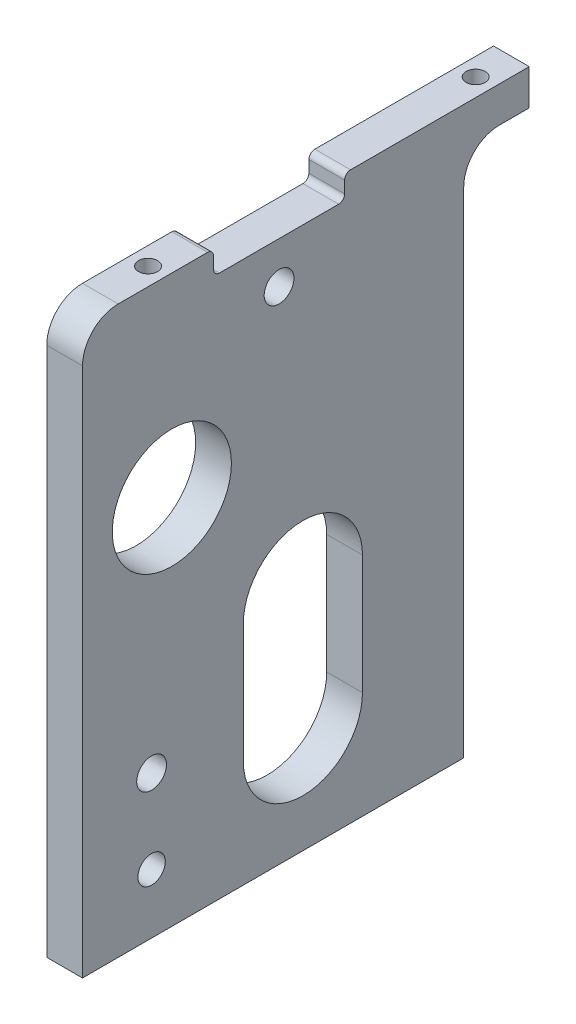
from build123d import *

# Parameters (mm, degrees)
SKETCH1_R                   = 5
SKETCH1_R_2                 = 1.15
BOSS_EXTRUDE1_DEPTH         = 1.5
FILLET1_R                   = 3
TAP_DRILL_FOR_M2_TAP1_D     = 1.6
TAP_DRILL_FOR_M2_TAP1_DEPTH = 6
TAP_DRILL_FOR_M2_TAP1_TIP   = 0.480688495
TAP_DRILL_FOR_M3_TAP1_D     = 2.5
SKETCH10_W                  = 11
SKETCH10_H                  = 2
CUT_EXTRUDE2_DEPTH          = 32.844348091
FILLET3_R                   = 0.5


with BuildPart() as part:
    # Sketch1 → Boss-Extrude1 (new, symmetric)
    with BuildSketch(Plane(origin=(0, 0, 0), x_dir=(0, 0, -1), z_dir=(1, 0, 0))):
        Polygon((-15.5, 23.75), (15.5, 23.75), (21, 23.75), (21, 20.75), (15.5, 20.75), (15.5, 8.25), (15.5, -23.75), (-15.5, -23.75), (-16.5, -23.75), (-16.5, 23.75), align=None)
        with Locations((-9, 7.422)):
            Circle(SKETCH1_R, mode=Mode.SUBTRACT)
        with Locations((-10.7, -18.75)):
            Circle(SKETCH1_R_2, mode=Mode.SUBTRACT)
        with BuildLine():
            Line((7, -4.75), (7, -14.75))
            ThreePointArc((7, -14.75), (2, -19.75), (-3, -14.75))
            Line((-3, -14.75), (-3, -4.75))
            ThreePointArc((-3, -4.75), (2, 0.25), (7, -4.75))
        make_face(mode=Mode.SUBTRACT)
    extrude(amount=BOSS_EXTRUDE1_DEPTH, both=True)

    # Fillet1
    fillet1_edges = [part.edges().sort_by_distance(p)[0] for p in [
        (0, 23.75, 16.5),
        (0, 20.75, -15.5),
    ]]
    fillet(fillet1_edges, radius=FILLET1_R)

    # Tap Drill for M2 Tap1
    with Locations(Plane(origin=(0, 23.75, 0), x_dir=(1, 0, 0), z_dir=(0, 1, 0))):
        with Locations((0, -9.5), (0, 18)):
            Hole(TAP_DRILL_FOR_M2_TAP1_D / 2, depth=TAP_DRILL_FOR_M2_TAP1_DEPTH)
            with Locations((0, 0, -(TAP_DRILL_FOR_M2_TAP1_DEPTH + TAP_DRILL_FOR_M2_TAP1_TIP / 2))):  # 118° drill point
                Cone(0, TAP_DRILL_FOR_M2_TAP1_D / 2, TAP_DRILL_FOR_M2_TAP1_TIP, mode=Mode.SUBTRACT)

    # Tap Drill for M3 Tap1 (through all)
    with Locations(Plane(origin=(1.5, 0, 0), x_dir=(0, 0, -1), z_dir=(1, 0, 0))):
        with Locations((-10.7, -11.75), (0, 18.25)):
            Hole(TAP_DRILL_FOR_M3_TAP1_D / 2)

    # Sketch10 → Cut-Extrude2 (cut, through all)
    with BuildSketch(Plane(origin=(1.5, 0, 0), x_dir=(0, 0, -1), z_dir=(1, 0, 0))):
        with Locations((0, 22.75)):
            Rectangle(SKETCH10_W, SKETCH10_H)
    extrude(amount=-CUT_EXTRUDE2_DEPTH, mode=Mode.SUBTRACT)

    # Fillet3
    fillet3_edges = [part.edges().sort_by_distance(p)[0] for p in [
        (0, 21.75, 5.5),
        (0, 23.75, 5.5),
        (0, 23.75, -5.5),
        (0, 21.75, -5.5),
    ]]
    fillet(fillet3_edges, radius=FILLET3_R)


solid = part.part
